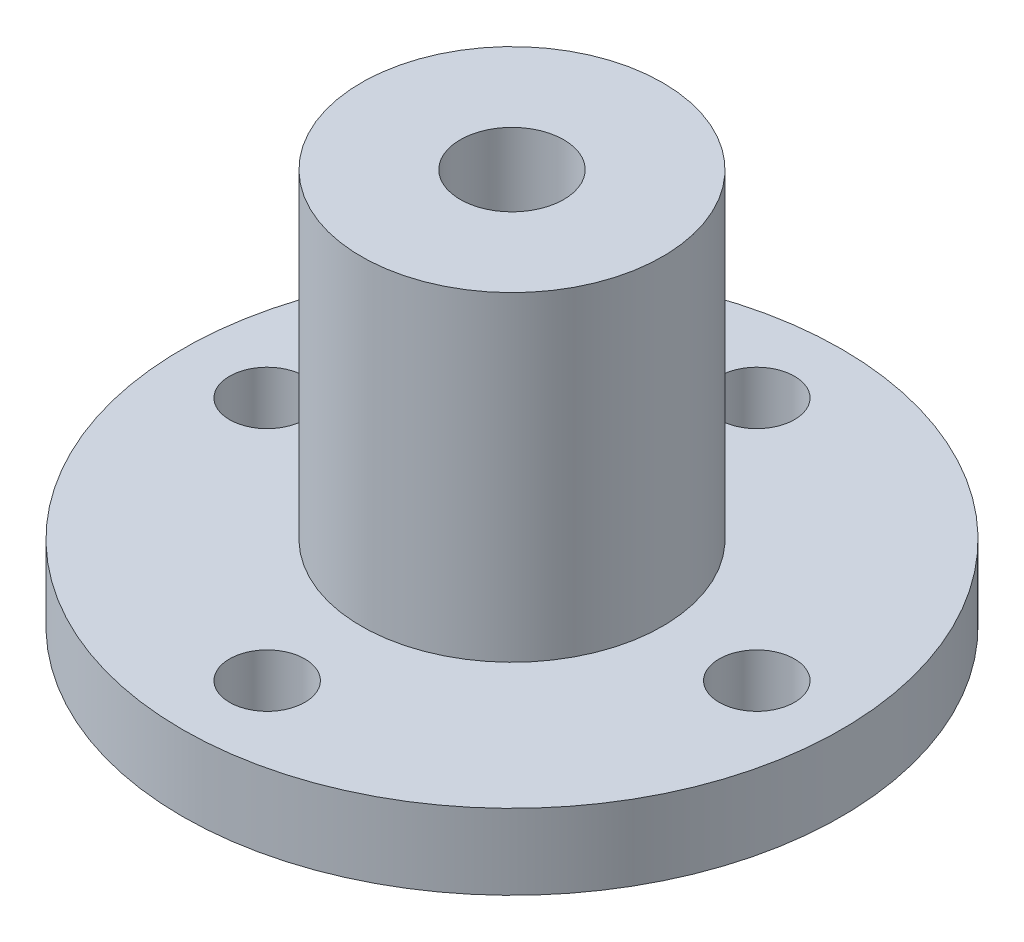
from build123d import *

# Parameters (mm, degrees)
SKETCH2_R           = 17.5
SKETCH2_R_2         = 8
SKETCH2_R_3         = 2
BOSS_EXTRUDE1_DEPTH = 4
SKETCH2_2_R         = 8
BOSS_EXTRUDE2_DEPTH = 21
SKETCH3_R           = 5.5
CUT_EXTRUDE1_DEPTH  = 12
SKETCH4_R           = 6
CUT_EXTRUDE2_DEPTH  = 1.1
SKETCH5_R           = 5.5
CUT_EXTRUDE3_DEPTH  = 2.9
SKETCH6_R           = 2.75
CUT_EXTRUDE4_DEPTH  = 5


with BuildPart() as part:
    # Sketch2 → Boss-Extrude1 (new body)
    with BuildSketch(Plane(origin=(0, 0, 0), x_dir=(1, 0, 0), z_dir=(0, 1, 0))):
        Circle(SKETCH2_R)
        Circle(SKETCH2_R_2, mode=Mode.SUBTRACT)
        with Locations((0, 13)):
            Circle(SKETCH2_R_3, mode=Mode.SUBTRACT)
        with Locations((13, 0)):
            Circle(SKETCH2_R_3, mode=Mode.SUBTRACT)
        with Locations((0, -13)):
            Circle(SKETCH2_R_3, mode=Mode.SUBTRACT)
        with Locations((-13, 0)):
            Circle(SKETCH2_R_3, mode=Mode.SUBTRACT)
    extrude(amount=BOSS_EXTRUDE1_DEPTH)

    # Sketch2<2> → Boss-Extrude2 (add)
    with BuildSketch(Plane(origin=(0, 0, 0), x_dir=(1, 0, 0), z_dir=(0, 1, 0))):
        Circle(SKETCH2_2_R)
    extrude(amount=BOSS_EXTRUDE2_DEPTH)

    # Sketch3 → Cut-Extrude1 (cut)
    with BuildSketch(Plane.XZ):
        Circle(SKETCH3_R)
    extrude(amount=-CUT_EXTRUDE1_DEPTH, mode=Mode.SUBTRACT)

    # Sketch4 → Cut-Extrude2 (cut)
    with BuildSketch(Plane.XZ.offset(-12)):
        Circle(SKETCH4_R)
    extrude(amount=-CUT_EXTRUDE2_DEPTH, mode=Mode.SUBTRACT)

    # Sketch5 → Cut-Extrude3 (cut)
    with BuildSketch(Plane.XZ.offset(-13.1)):
        Circle(SKETCH5_R)
    extrude(amount=-CUT_EXTRUDE3_DEPTH, mode=Mode.SUBTRACT)

    # Sketch6 → Cut-Extrude4 (cut)
    with BuildSketch(Plane.XZ.offset(-16)):
        Circle(SKETCH6_R)
    extrude(amount=-CUT_EXTRUDE4_DEPTH, mode=Mode.SUBTRACT)


solid = part.part
